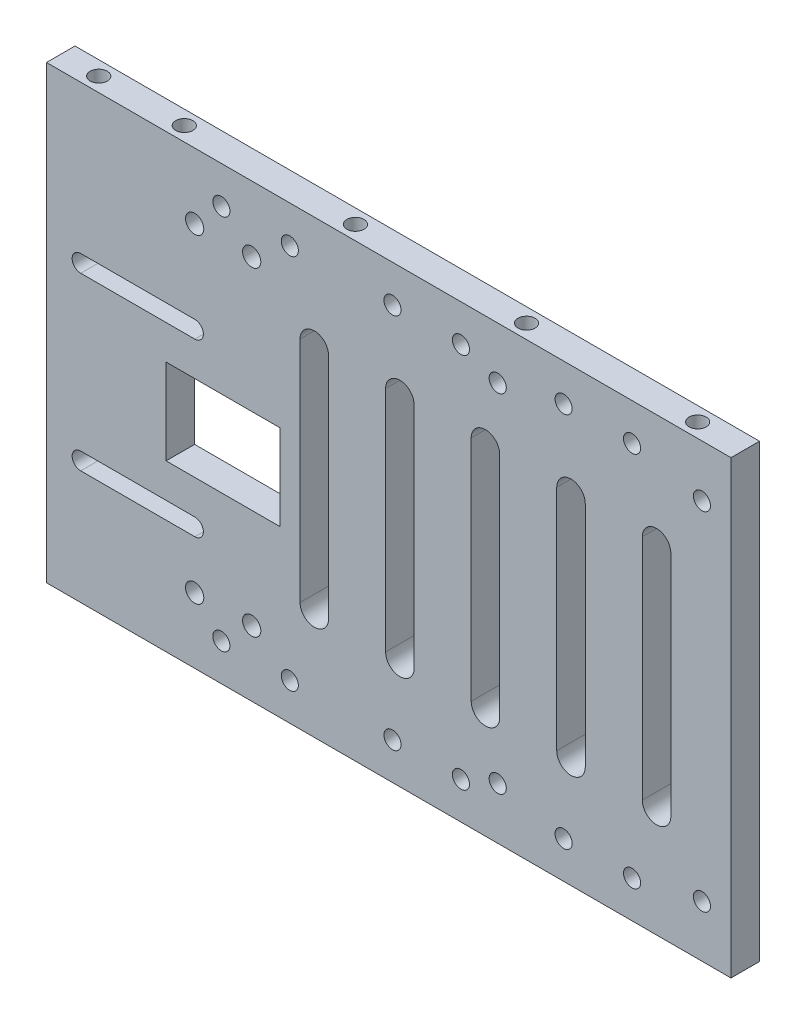
from build123d import *

# Parameters (mm, degrees)
SKETCH_1_W               = 120
SKETCH_1_H               = 79
EXTRUDE_1_DEPTH          = 5
SKETCH_2_R               = 3.1
CUT_EXTRUDE_1_DEPTH      = 2
SKETCH_3_R               = 1.5
CUT_EXTRUDE_2_DEPTH      = 72.897496479
PATTERN_LINEAR_1_COUNT   = 3
PATTERN_LINEAR_1_PITCH   = 30
MIRROR_2_COPY_1_SKETCH_R = 3.1
MIRROR_2_COPY_1_DEPTH    = 2
MIRROR_2_COPY_2_SKETCH_R = 3.1
MIRROR_2_COPY_2_DEPTH    = 2
MIRROR_2_COPY_3_SKETCH_R = 1.5
MIRROR_2_COPY_3_DEPTH    = 72.897496479
MIRROR_2_COPY_4_SKETCH_R = 1.5
MIRROR_2_COPY_4_DEPTH    = 72.897496479
CUT_EXTRUDE_3_DEPTH      = 1.5
CUT_EXTRUDE_4_DEPTH      = 72.920094549
SKETCH_7_R               = 1.5
CUT_EXTRUDE_6_DEPTH      = 5
SKETCH_9_R               = 1.6
SKETCH_9_R_2             = 1.5
CUT_EXTRUDE_7_DEPTH      = 73.008680032
SKETCH_11_W              = 10
SKETCH_11_H              = 15
CUT_EXTRUDE_8_DEPTH      = 73.008680032


with BuildPart() as part:
    # 草图1 → 凸台-拉伸1 (new body)
    with BuildSketch(Plane.XY):
        Rectangle(SKETCH_1_W, SKETCH_1_H)
    extrude(amount=EXTRUDE_1_DEPTH)

    # 草图2 → 切除-拉伸1 (cut)
    with BuildSketch(Plane(origin=(0, 0, 0), x_dir=(-1, 0, 0), z_dir=(0, 0, -1))):
        with Locations((-42.655984764, -33)):
            Circle(SKETCH_2_R)
        with Locations((-30.655984764, -33)):
            Circle(SKETCH_2_R)
    cut_extrude_1 = extrude(amount=-CUT_EXTRUDE_1_DEPTH, mode=Mode.SUBTRACT)

    # 草图3 → 切除-拉伸2 (cut, through all)
    with BuildSketch(Plane(origin=(0, 0, 2), x_dir=(-1, 0, 0), z_dir=(0, 0, -1))):
        with Locations((-42.655984764, -33)):
            Circle(SKETCH_3_R)
        with Locations((-30.655984764, -33)):
            Circle(SKETCH_3_R)
    cut_extrude_2 = extrude(amount=-CUT_EXTRUDE_2_DEPTH, mode=Mode.SUBTRACT)

    # 阵列(线性)1: 切除-拉伸1, 切除-拉伸2 ×3
    with Locations(*[(-i * PATTERN_LINEAR_1_PITCH, 0, 0) for i in range(1, PATTERN_LINEAR_1_COUNT)]):
        add(cut_extrude_1, mode=Mode.SUBTRACT)
        add(cut_extrude_2, mode=Mode.SUBTRACT)

    # 镜向2: 切除-拉伸1, 切除-拉伸2 across plane
    add(cut_extrude_1.mirror(Plane.ZX), mode=Mode.SUBTRACT)
    add(cut_extrude_2.mirror(Plane.ZX), mode=Mode.SUBTRACT)

    # 镜向2 copy 1 sketch → 镜向2 copy 1 (cut)
    with BuildSketch(Plane(origin=(-30, 0, 0), x_dir=(-1, 0, 0), z_dir=(0, 0, -1))):
        with Locations((-42.655984764, 33)):
            Circle(MIRROR_2_COPY_1_SKETCH_R)
        with Locations((-30.655984764, 33)):
            Circle(MIRROR_2_COPY_1_SKETCH_R)
    extrude(amount=-MIRROR_2_COPY_1_DEPTH, mode=Mode.SUBTRACT)

    # 镜向2 copy 2 sketch → 镜向2 copy 2 (cut)
    with BuildSketch(Plane(origin=(-60, 0, 0), x_dir=(-1, 0, 0), z_dir=(0, 0, -1))):
        with Locations((-42.655984764, 33)):
            Circle(MIRROR_2_COPY_2_SKETCH_R)
        with Locations((-30.655984764, 33)):
            Circle(MIRROR_2_COPY_2_SKETCH_R)
    extrude(amount=-MIRROR_2_COPY_2_DEPTH, mode=Mode.SUBTRACT)

    # 镜向2 copy 3 sketch → 镜向2 copy 3 (cut, through all)
    with BuildSketch(Plane(origin=(-30, 0, 2), x_dir=(-1, 0, 0), z_dir=(0, 0, -1))):
        with Locations((-42.655984764, 33)):
            Circle(MIRROR_2_COPY_3_SKETCH_R)
        with Locations((-30.655984764, 33)):
            Circle(MIRROR_2_COPY_3_SKETCH_R)
    extrude(amount=-MIRROR_2_COPY_3_DEPTH, mode=Mode.SUBTRACT)

    # 镜向2 copy 4 sketch → 镜向2 copy 4 (cut, through all)
    with BuildSketch(Plane(origin=(-60, 0, 2), x_dir=(-1, 0, 0), z_dir=(0, 0, -1))):
        with Locations((-42.655984764, 33)):
            Circle(MIRROR_2_COPY_4_SKETCH_R)
        with Locations((-30.655984764, 33)):
            Circle(MIRROR_2_COPY_4_SKETCH_R)
    extrude(amount=-MIRROR_2_COPY_4_DEPTH, mode=Mode.SUBTRACT)

    # 草图4 → 切除-拉伸3 (cut)
    with BuildSketch(Plane(origin=(0, 0, 0), x_dir=(-1, 0, 0), z_dir=(0, 0, -1))):
        with BuildLine():
            Line((34, 15.1), (54, 15.1))
            ThreePointArc((54, 15.1), (57.1, 12), (54, 8.9))
            Line((54, 8.9), (34, 8.9))
            ThreePointArc((34, 8.9), (30.9, 12), (34, 15.1))
        make_face()
        with BuildLine():
            Line((34, -21.1), (54, -21.1))
            ThreePointArc((54, -21.1), (57.1, -18), (54, -14.9))
            Line((54, -14.9), (34, -14.9))
            ThreePointArc((34, -14.9), (30.9, -18), (34, -21.1))
        make_face()
    extrude(amount=-CUT_EXTRUDE_3_DEPTH, mode=Mode.SUBTRACT)

    # 草图5 → 切除-拉伸4 (cut, through all)
    with BuildSketch(Plane(origin=(0, 0, 1.5), x_dir=(-1, 0, 0), z_dir=(0, 0, -1))):
        with BuildLine():
            Line((54, 10.5), (34, 10.5))
            ThreePointArc((34, 10.5), (32.5, 12), (34, 13.5))
            Line((34, 13.5), (54, 13.5))
            ThreePointArc((54, 13.5), (55.5, 12), (54, 10.5))
        make_face()
        with BuildLine():
            Line((54, -16.5), (34, -16.5))
            ThreePointArc((34, -16.5), (32.5, -18), (34, -19.5))
            Line((34, -19.5), (54, -19.5))
            ThreePointArc((54, -19.5), (55.5, -18), (54, -16.5))
        make_face()
    extrude(amount=-CUT_EXTRUDE_4_DEPTH, mode=Mode.SUBTRACT)

    # 草图7 → 切除-拉伸6 (cut)
    with BuildSketch(Plane.XZ.offset(39.5)):
        with Locations(Location((51.655984764, 2.5, 0), (0, 0, 270))):
            Circle(SKETCH_7_R)
        with Locations(Location((21.655984764, 2.5, 0), (0, 0, 270))):
            Circle(SKETCH_7_R)
        with Locations(Location((-8.344015236, 2.5, 0), (0, 0, 270))):
            Circle(SKETCH_7_R)
        with Locations(Location((-38.344015236, 2.5, 0), (0, 0, 270))):
            Circle(SKETCH_7_R)
        with Locations(Location((-53.344015236, 2.5, 0), (0, 0, 270))):
            Circle(SKETCH_7_R)
    cut_extrude_6 = extrude(amount=-CUT_EXTRUDE_6_DEPTH, mode=Mode.SUBTRACT)

    # 镜向3: 切除-拉伸6 across plane
    add(cut_extrude_6.mirror(Plane.ZX), mode=Mode.SUBTRACT)

    # 草图9 → 切除-拉伸7 (cut, through all)
    with BuildSketch(Plane(origin=(0, 0, 0), x_dir=(-1, 0, 0), z_dir=(0, 0, -1))):
        with Locations((24.027682272, -28)):
            Circle(SKETCH_9_R)
        with Locations((34.027682272, -28)):
            Circle(SKETCH_9_R)
        with Locations((24.027682272, 28)):
            Circle(SKETCH_9_R)
        with Locations((34.027682272, 28)):
            Circle(SKETCH_9_R)
        with Locations((-19.103783252, 30.4)):
            Circle(SKETCH_9_R_2)
        with Locations((-54.903783252, 30.4)):
            Circle(SKETCH_9_R_2)
        with Locations((-19.103783252, -30.4)):
            Circle(SKETCH_9_R_2)
        with Locations((-54.903783252, -30.4)):
            Circle(SKETCH_9_R_2)
        with BuildLine():
            Line((-49.452559424, -20.266203112), (-49.452559424, 19.733796888))
            ThreePointArc((-49.452559424, 19.733796888), (-46.952559424, 22.233796888), (-44.452559424, 19.733796888))
            Line((-44.452559424, 19.733796888), (-44.452559424, -20.266203112))
            ThreePointArc((-44.452559424, -20.266203112), (-46.952559424, -22.766203112), (-49.452559424, -20.266203112))
        make_face()
        with BuildLine():
            Line((-34.452559424, -20.266203112), (-34.452559424, 19.733796888))
            ThreePointArc((-34.452559424, 19.733796888), (-31.952559424, 22.233796888), (-29.452559424, 19.733796888))
            Line((-29.452559424, 19.733796888), (-29.452559424, -20.266203112))
            ThreePointArc((-29.452559424, -20.266203112), (-31.952559424, -22.766203112), (-34.452559424, -20.266203112))
        make_face()
        with BuildLine():
            Line((-19.452559424, -20.266203112), (-19.452559424, 19.733796888))
            ThreePointArc((-19.452559424, 19.733796888), (-16.952559424, 22.233796888), (-14.452559424, 19.733796888))
            Line((-14.452559424, 19.733796888), (-14.452559424, -20.266203112))
            ThreePointArc((-14.452559424, -20.266203112), (-16.952559424, -22.766203112), (-19.452559424, -20.266203112))
        make_face()
        with BuildLine():
            Line((-4.452559424, -20.266203112), (-4.452559424, 19.733796888))
            ThreePointArc((-4.452559424, 19.733796888), (-1.952559424, 22.233796888), (0.547440576, 19.733796888))
            Line((0.547440576, 19.733796888), (0.547440576, -20.266203112))
            ThreePointArc((0.547440576, -20.266203112), (-1.952559424, -22.766203112), (-4.452559424, -20.266203112))
        make_face()
        with BuildLine():
            Line((10.547440576, -20.266203112), (10.547440576, 19.733796888))
            ThreePointArc((10.547440576, 19.733796888), (13.047440576, 22.233796888), (15.547440576, 19.733796888))
            Line((15.547440576, 19.733796888), (15.547440576, -20.266203112))
            ThreePointArc((15.547440576, -20.266203112), (13.047440576, -22.766203112), (10.547440576, -20.266203112))
        make_face()
    extrude(amount=-CUT_EXTRUDE_7_DEPTH, mode=Mode.SUBTRACT)

    # 草图11 → 切除-拉伸8 (cut, through all)
    with BuildSketch(Plane.XY.offset(5)):
        with Locations((-24.027682272, -3)):
            Rectangle(SKETCH_11_W, SKETCH_11_H)
        with Locations((-34.027682272, -3)):
            Rectangle(SKETCH_11_W, SKETCH_11_H)
    extrude(amount=-CUT_EXTRUDE_8_DEPTH, mode=Mode.SUBTRACT)


solid = part.part
